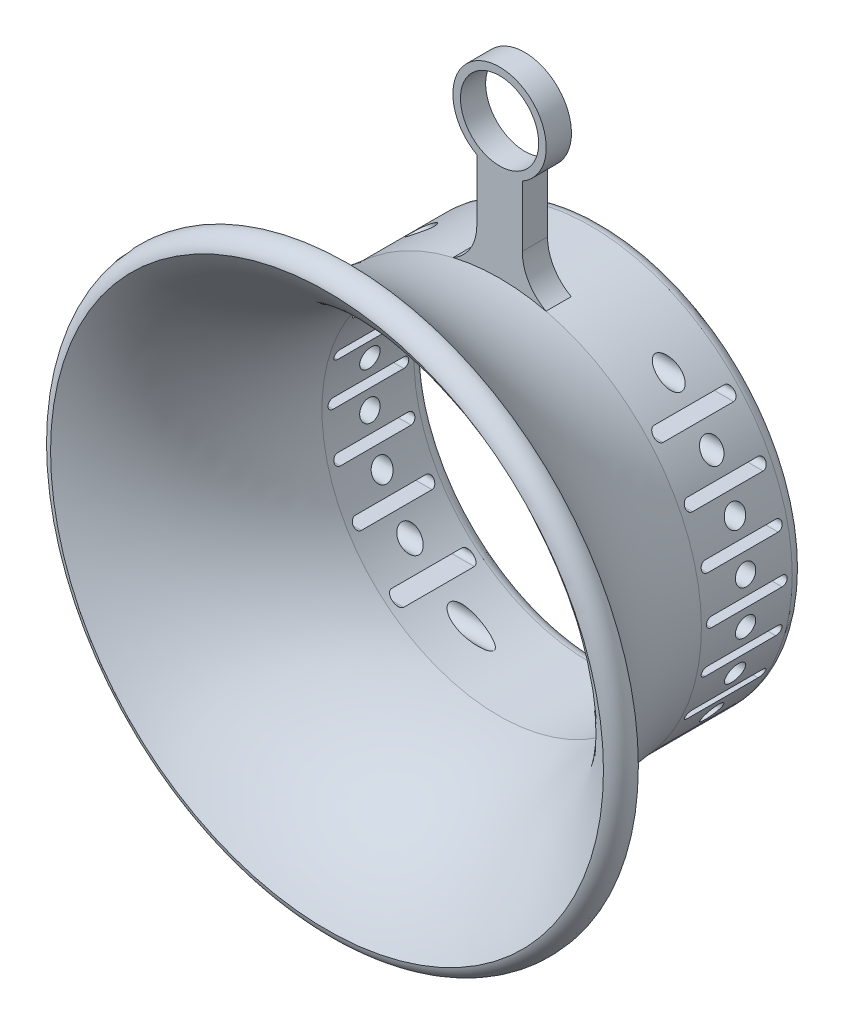
from build123d import *

# Parameters (mm, degrees)
SKETCH10_R              = 7.75
BOSS_EXTRUDE4_DEPTH     = 5
CUT_EXTRUDE1_DEPTH      = 151.634010976
CUT_EXTRUDE1_DEPTH_BACK = 151.634010976
CUT_EXTRUDE2_DEPTH      = 151.634010976
CUT_EXTRUDE2_DEPTH_BACK = 151.634010976
SKETCH12_R              = 2


with BuildPart() as part:
    # Sketch1 → Revolve2 (revolve)
    with BuildSketch(Plane(origin=(0, 0, 0), x_dir=(0, 0, -1), z_dir=(1, 0, 0)), mode=Mode.PRIVATE) as revolve2_sk:
        with BuildLine():
            Line((-3.041371927, 40), (-21.041371927, 40))
            add(Edge.make_bspline(
                [(-21.041371927, 40), (-40.789069163, 41.620924159), (-51.041371927, 57.5)],
                knots=[0, 0, 0, 1, 1, 1], degree=2))
            ThreePointArc((-51.041371927, 57.5), (-53.703337251, 57.013922756), (-55.241922467, 54.78792051))
            add(Edge.make_bspline(
                [(-21.24623165, 35), (-21.478177645, 35.018557089), (-21.991335272, 35.063137483), (-22.74891418, 35.136080742), (-24.254633084, 35.308695168), (-27.209949718, 35.76052632), (-32.899717049, 37.096821964), (-41.010913024, 40.553265445), (-50.948903514, 48.108705605), (-55.241922467, 54.78792051)],
                knots=[-0.005169541, -0.005169541, -0.005169541, 0.006609789, 0.01838912, 0.041947781, 0.089065103, 0.183299748, 0.371769037, 0.623061422, 1, 1, 1], degree=2))
            Line((-21.24623165, 35), (-3.041371927, 35))
            ThreePointArc((-3.041371927, 35), (-0.541371927, 37.5), (-3.041371927, 40))
        make_face()
    revolve(revolve2_sk.sketch.rotate(Axis((0, 0, 41.235909689), (0, 0, -1)), 90), axis=Axis((0, 0, 41.235909689), (0, 0, -1)))

    # Sketch10 → Boss-Extrude4 (add)
    # profile 1 of 2: a face of its own
    with BuildSketch(Plane.XY.offset(21.05)):
        with BuildLine():
            Line((4.5, 46.835806853), (4.5, 58.918385062))
            ThreePointArc((4.5, 58.918385062), (0, 76.25), (-4.5, 58.918385062))
            Line((-4.5, 58.918385062), (-4.5, 46.835806853))
            ThreePointArc((-4.5, 46.835806853), (-5.876918447, 42.051600791), (-9.586361697, 38.731275081))
            ThreePointArc((-9.586361697, 38.731275081), (0, 39.9), (9.586361697, 38.731275081))
            ThreePointArc((9.586361697, 38.731275081), (5.876918447, 42.051600791), (4.5, 46.835806853))
        make_face()
        with Locations((0, 67)):
            Circle(SKETCH10_R, mode=Mode.SUBTRACT)
    # profile 2 of 2: a face of its own
    with BuildSketch(Plane.XY.offset(21.05)):
        with BuildLine():
            Line((4.5, -58.918385062), (4.5, -46.835806853))
            ThreePointArc((4.5, -46.835806853), (5.876918447, -42.051600791), (9.586361697, -38.731275081))
            ThreePointArc((9.586361697, -38.731275081), (0, -39.9), (-9.586361697, -38.731275081))
            ThreePointArc((-9.586361697, -38.731275081), (-5.876918447, -42.051600791), (-4.5, -46.835806853))
            Line((-4.5, -46.835806853), (-4.5, -58.918385062))
            ThreePointArc((-4.5, -58.918385062), (0, -76.25), (4.5, -58.918385062))
        make_face()
        with Locations((0, -67)):
            Circle(SKETCH10_R, mode=Mode.SUBTRACT)
    extrude(amount=-BOSS_EXTRUDE4_DEPTH)

    # Sketch11 → Cut-Extrude1 (cut, two sides: drawn at the far end of the back side and taken through both)
    with BuildSketch(Plane(origin=(60, 0, 0), x_dir=(0, 0, -1), z_dir=(1, 0, 0)).offset(-CUT_EXTRUDE1_DEPTH_BACK)):
        with BuildLine():
            Line((-19.041371927, 1), (-5.041371927, 1))
            ThreePointArc((-5.041371927, 1), (-4.041371927, 0), (-5.041371927, -1))
            Line((-5.041371927, -1), (-19.041371927, -1))
            ThreePointArc((-19.041371927, -1), (-20.041371927, 0), (-19.041371927, 1))
        make_face()
        with BuildLine():
            Line((-19.041371927, 10), (-5.041371927, 10))
            ThreePointArc((-5.041371927, 10), (-4.041371927, 9), (-5.041371927, 8))
            Line((-5.041371927, 8), (-19.041371927, 8))
            ThreePointArc((-19.041371927, 8), (-20.041371927, 9), (-19.041371927, 10))
        make_face()
        with BuildLine():
            Line((-19.041371927, 19), (-5.041371927, 19))
            ThreePointArc((-5.041371927, 19), (-4.041371927, 18), (-5.041371927, 17))
            Line((-5.041371927, 17), (-19.041371927, 17))
            ThreePointArc((-19.041371927, 17), (-20.041371927, 18), (-19.041371927, 19))
        make_face()
        with BuildLine():
            Line((-19.041371927, 28), (-5.041371927, 28))
            ThreePointArc((-5.041371927, 28), (-4.041371927, 27), (-5.041371927, 26))
            Line((-5.041371927, 26), (-19.041371927, 26))
            ThreePointArc((-19.041371927, 26), (-20.041371927, 27), (-19.041371927, 28))
        make_face()
        with BuildLine():
            Line((-19.041371927, -10), (-5.041371927, -10))
            ThreePointArc((-5.041371927, -10), (-4.041371927, -9), (-5.041371927, -8))
            Line((-5.041371927, -8), (-19.041371927, -8))
            ThreePointArc((-19.041371927, -8), (-20.041371927, -9), (-19.041371927, -10))
        make_face()
        with BuildLine():
            Line((-19.041371927, -19), (-5.041371927, -19))
            ThreePointArc((-5.041371927, -19), (-4.041371927, -18), (-5.041371927, -17))
            Line((-5.041371927, -17), (-19.041371927, -17))
            ThreePointArc((-19.041371927, -17), (-20.041371927, -18), (-19.041371927, -19))
        make_face()
        with BuildLine():
            Line((-19.041371927, -28), (-5.041371927, -28))
            ThreePointArc((-5.041371927, -28), (-4.041371927, -27), (-5.041371927, -26))
            Line((-5.041371927, -26), (-19.041371927, -26))
            ThreePointArc((-19.041371927, -26), (-20.041371927, -27), (-19.041371927, -28))
        make_face()
    extrude(amount=CUT_EXTRUDE1_DEPTH + CUT_EXTRUDE1_DEPTH_BACK, mode=Mode.SUBTRACT)

    # Sketch12 → Cut-Extrude2 (cut, two sides: drawn at the far end of the back side and taken through both)
    with BuildSketch(Plane(origin=(60, 0, 0), x_dir=(0, 0, -1), z_dir=(1, 0, 0)).offset(-CUT_EXTRUDE2_DEPTH_BACK)):
        with Locations((-12.041371927, 4.5)):
            Circle(SKETCH12_R)
        with Locations((-12.041371927, 13.5)):
            Circle(SKETCH12_R)
        with Locations((-12.041371927, 22.5)):
            Circle(SKETCH12_R)
        with Locations((-12.041371927, 31.5)):
            Circle(SKETCH12_R)
        with Locations((-12.041371927, -4.5)):
            Circle(SKETCH12_R)
        with Locations((-12.041371927, -13.5)):
            Circle(SKETCH12_R)
        with Locations((-12.041371927, -22.5)):
            Circle(SKETCH12_R)
        with Locations((-12.041371927, -31.5)):
            Circle(SKETCH12_R)
    extrude(amount=CUT_EXTRUDE2_DEPTH + CUT_EXTRUDE2_DEPTH_BACK, mode=Mode.SUBTRACT)


solid = part.part
